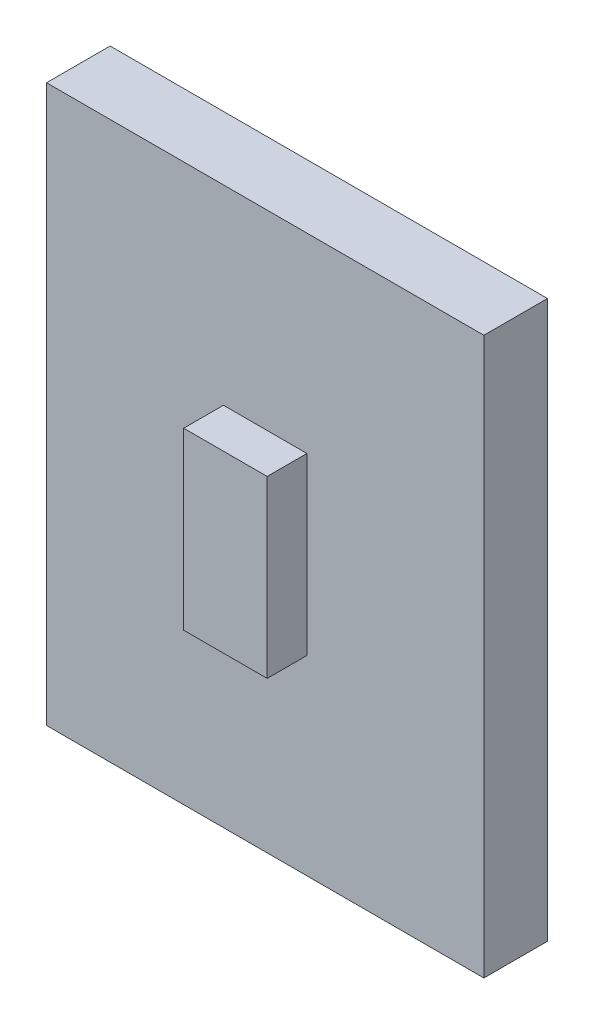
from build123d import *

# Parameters (mm, degrees)
ESQUISSE1_W        = 11
ESQUISSE1_H        = 14
BOSS_EXTRU_1_DEPTH = 1.6
ESQUISSE2_W        = 2.1
ESQUISSE2_H        = 4.4
BOSS_EXTRU_2_DEPTH = 1


with BuildPart() as part:
    # Esquisse1 → Boss.-Extru.1 (new body)
    with BuildSketch(Plane.XY):
        with Locations((5.5, 7)):
            Rectangle(ESQUISSE1_W, ESQUISSE1_H)
    extrude(amount=BOSS_EXTRU_1_DEPTH)

    # Esquisse2 → Boss.-Extru.2 (add)
    with BuildSketch(Plane.XY.offset(1.6)):
        with Locations((5.5, 7)):
            Rectangle(ESQUISSE2_W, ESQUISSE2_H)
    extrude(amount=BOSS_EXTRU_2_DEPTH)


solid = part.part
